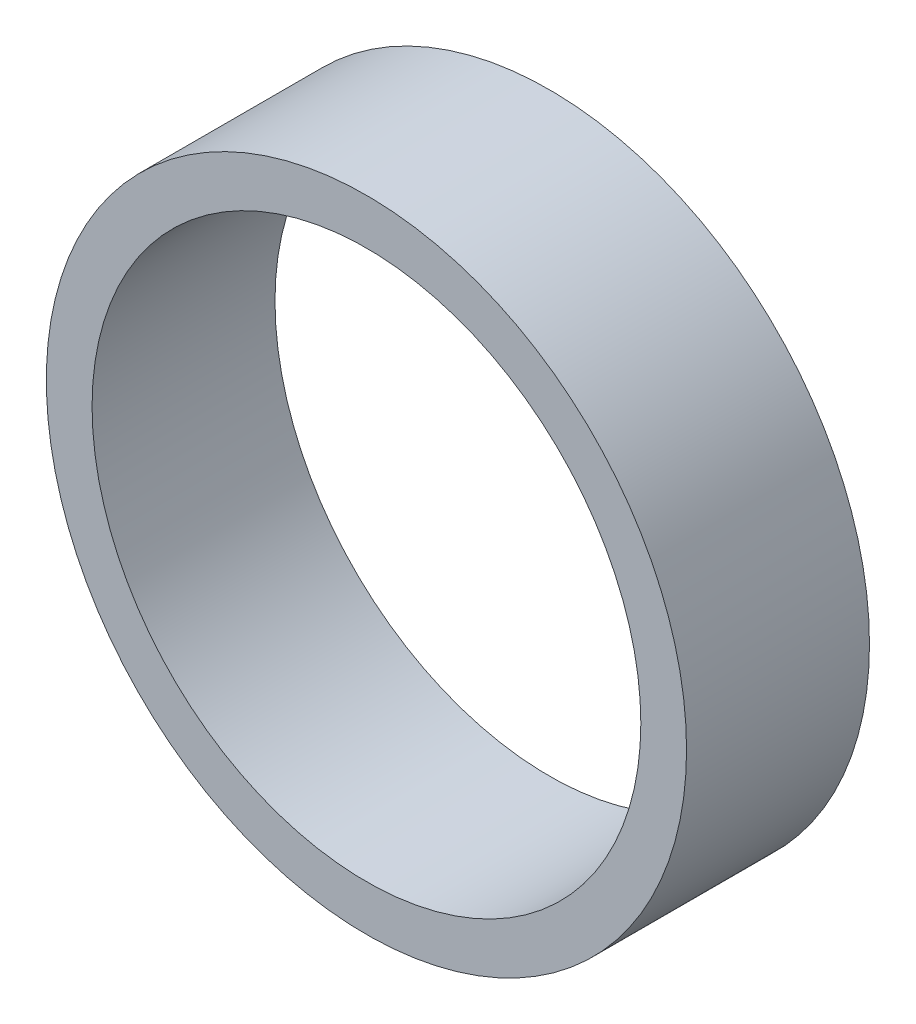
from build123d import *

# Parameters (mm, degrees)
SKETCH1_R           = 70
SKETCH1_R_2         = 60
BOSS_EXTRUDE1_DEPTH = 20


with BuildPart() as part:
    # Sketch1 → Boss-Extrude1 (new, symmetric)
    with BuildSketch(Plane.XY):
        Circle(SKETCH1_R)
        Circle(SKETCH1_R_2, mode=Mode.SUBTRACT)
    extrude(amount=BOSS_EXTRUDE1_DEPTH, both=True)


solid = part.part
